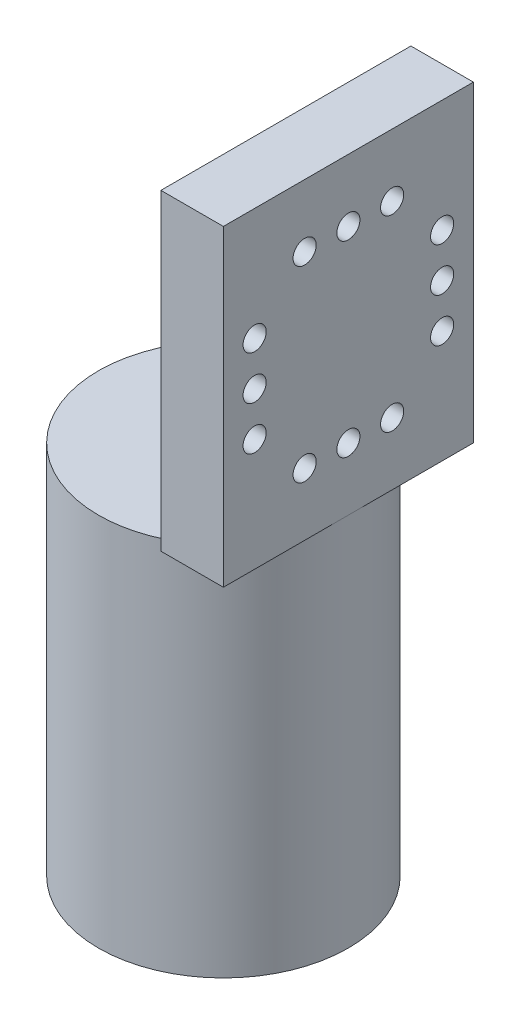
from build123d import *

# Parameters (mm, degrees)
SKETCH_1_R          = 10
EXTRUDE_1_DEPTH     = 30
SKETCH_1_3_W        = 5
SKETCH_1_3_H        = 20
EXTRUDE_2_DEPTH     = 25
SKETCH_2_R          = 0.925
CUT_EXTRUDE_1_DEPTH = 38.416573868
SKETCH_3_R          = 5.05
CUT_EXTRUDE_2_DEPTH = 25


with BuildPart() as part:
    # Эскиз1 → Бобышка-Вытянуть1 (new body)
    with BuildSketch(Plane(origin=(0, 0, 0), x_dir=(1, 0, 0), z_dir=(0, 1, 0))):
        Circle(SKETCH_1_R)
    extrude(amount=-EXTRUDE_1_DEPTH)

    # Эскиз1<3> → Бобышка-Вытянуть2 (add)
    with BuildSketch(Plane(origin=(0, 0, 0), x_dir=(1, 0, 0), z_dir=(0, 1, 0))):
        with Locations((7.5, 0)):
            Rectangle(SKETCH_1_3_W, SKETCH_1_3_H)
    extrude(amount=EXTRUDE_2_DEPTH)

    # Эскиз2 → Вырез-Вытянуть1 (cut, through all)
    with BuildSketch(Plane(origin=(10, 0, 0), x_dir=(0, 0, -1), z_dir=(1, 0, 0))):
        with Locations((0, 5)):
            Circle(SKETCH_2_R)
        with Locations((3.5, 5)):
            Circle(SKETCH_2_R)
        with Locations((-3.5, 5)):
            Circle(SKETCH_2_R)
        with Locations((0, 20)):
            Circle(SKETCH_2_R)
        with Locations((-3.5, 20)):
            Circle(SKETCH_2_R)
        with Locations((3.5, 20)):
            Circle(SKETCH_2_R)
        with Locations((-7.5, 12.5)):
            Circle(SKETCH_2_R)
        with Locations((7.5, 12.5)):
            Circle(SKETCH_2_R)
        with Locations((-7.5, 9)):
            Circle(SKETCH_2_R)
        with Locations((-7.5, 16)):
            Circle(SKETCH_2_R)
        with Locations((7.5, 9)):
            Circle(SKETCH_2_R)
        with Locations((7.5, 16)):
            Circle(SKETCH_2_R)
    extrude(amount=-CUT_EXTRUDE_1_DEPTH, mode=Mode.SUBTRACT)

    # Эскиз3 → Вырез-Вытянуть2 (cut)
    with BuildSketch(Plane.XZ.offset(30)):
        Circle(SKETCH_3_R)
    extrude(amount=-CUT_EXTRUDE_2_DEPTH, mode=Mode.SUBTRACT)


solid = part.part
